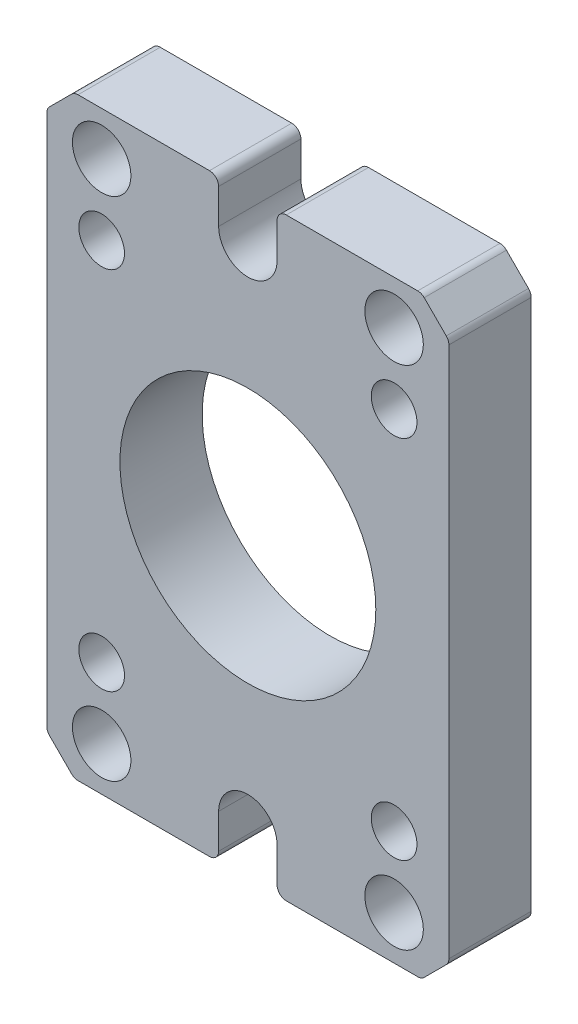
from build123d import *

# Parameters (mm, degrees)
ESBO_O1_R                = 7
ESBO_O1_R_2              = 1.6
ESBO_O1_R_3              = 1.25
RESSALTO_EXTRUS_O1_DEPTH = 4.5


with BuildPart() as part:
    # Esboço1 → Ressalto-extrusão1 (new body)
    with BuildSketch(Plane(origin=(0, 0, 0), x_dir=(-1, 0, 0), z_dir=(0, 0, -1))):
        with BuildLine():
            Line((-2.1, 16.25), (-9.292893219, 16.25))
            ThreePointArc((-9.292893219, 16.25), (-9.484234935, 16.211939766), (-9.646446609, 16.103553391))
            Line((-9.646446609, 16.103553391), (-10.853553391, 14.896446609))
            ThreePointArc((-10.853553391, 14.896446609), (-10.961939766, 14.734234935), (-11, 14.542893219))
            Line((-11, 14.542893219), (-11, -14.542893219))
            ThreePointArc((-11, -14.542893219), (-10.961939766, -14.734234935), (-10.853553391, -14.896446609))
            Line((-10.853553391, -14.896446609), (-9.646446609, -16.103553391))
            ThreePointArc((-9.646446609, -16.103553391), (-9.484234935, -16.211939766), (-9.292893219, -16.25))
            Line((-9.292893219, -16.25), (-2.1, -16.25))
            ThreePointArc((-2.1, -16.25), (-1.746446609, -16.103553391), (-1.6, -15.75))
            Line((-1.6, -15.75), (-1.6, -13.856406461))
            ThreePointArc((-1.6, -13.856406461), (0, -12.256406461), (1.6, -13.856406461))
            Line((1.6, -13.856406461), (1.6, -15.75))
            ThreePointArc((1.6, -15.75), (1.746446609, -16.103553391), (2.1, -16.25))
            Line((2.1, -16.25), (9.292893219, -16.25))
            ThreePointArc((9.292893219, -16.25), (9.484234935, -16.211939766), (9.646446609, -16.103553391))
            Line((9.646446609, -16.103553391), (10.853553391, -14.896446609))
            ThreePointArc((10.853553391, -14.896446609), (10.961939766, -14.734234935), (11, -14.542893219))
            Line((11, -14.542893219), (11, 14.542893219))
            ThreePointArc((11, 14.542893219), (10.961939766, 14.734234935), (10.853553391, 14.896446609))
            Line((10.853553391, 14.896446609), (9.646446609, 16.103553391))
            ThreePointArc((9.646446609, 16.103553391), (9.484234935, 16.211939766), (9.292893219, 16.25))
            Line((9.292893219, 16.25), (2.1, 16.25))
            ThreePointArc((2.1, 16.25), (1.746446609, 16.103553391), (1.6, 15.75))
            Line((1.6, 15.75), (1.6, 13.856406461))
            ThreePointArc((1.6, 13.856406461), (0, 12.256406461), (-1.6, 13.856406461))
            Line((-1.6, 13.856406461), (-1.6, 15.75))
            ThreePointArc((-1.6, 15.75), (-1.746446609, 16.103553391), (-2.1, 16.25))
        make_face()
        with Locations(Location((0, 0, 0), (0, 0, 180))):
            Circle(ESBO_O1_R, mode=Mode.SUBTRACT)
        with Locations(Location((-8, -13.85640646, 0), (0, 0, 180))):
            Circle(ESBO_O1_R_2, mode=Mode.SUBTRACT)
        with Locations(Location((8, -13.85640646, 0), (0, 0, 180))):
            Circle(ESBO_O1_R_2, mode=Mode.SUBTRACT)
        with Locations(Location((8, 13.85640646, 0), (0, 0, 180))):
            Circle(ESBO_O1_R_2, mode=Mode.SUBTRACT)
        with Locations(Location((-8, 13.85640646, 0), (0, 0, 180))):
            Circle(ESBO_O1_R_2, mode=Mode.SUBTRACT)
        with Locations(Location((-8, -10, 0), (0, 0, 180))):
            Circle(ESBO_O1_R_3, mode=Mode.SUBTRACT)
        with Locations(Location((8, -10, 0), (0, 0, 180))):
            Circle(ESBO_O1_R_3, mode=Mode.SUBTRACT)
        with Locations(Location((8, 10, 0), (0, 0, 180))):
            Circle(ESBO_O1_R_3, mode=Mode.SUBTRACT)
        with Locations(Location((-8, 10, 0), (0, 0, 180))):
            Circle(ESBO_O1_R_3, mode=Mode.SUBTRACT)
    extrude(amount=-RESSALTO_EXTRUS_O1_DEPTH)


solid = part.part
